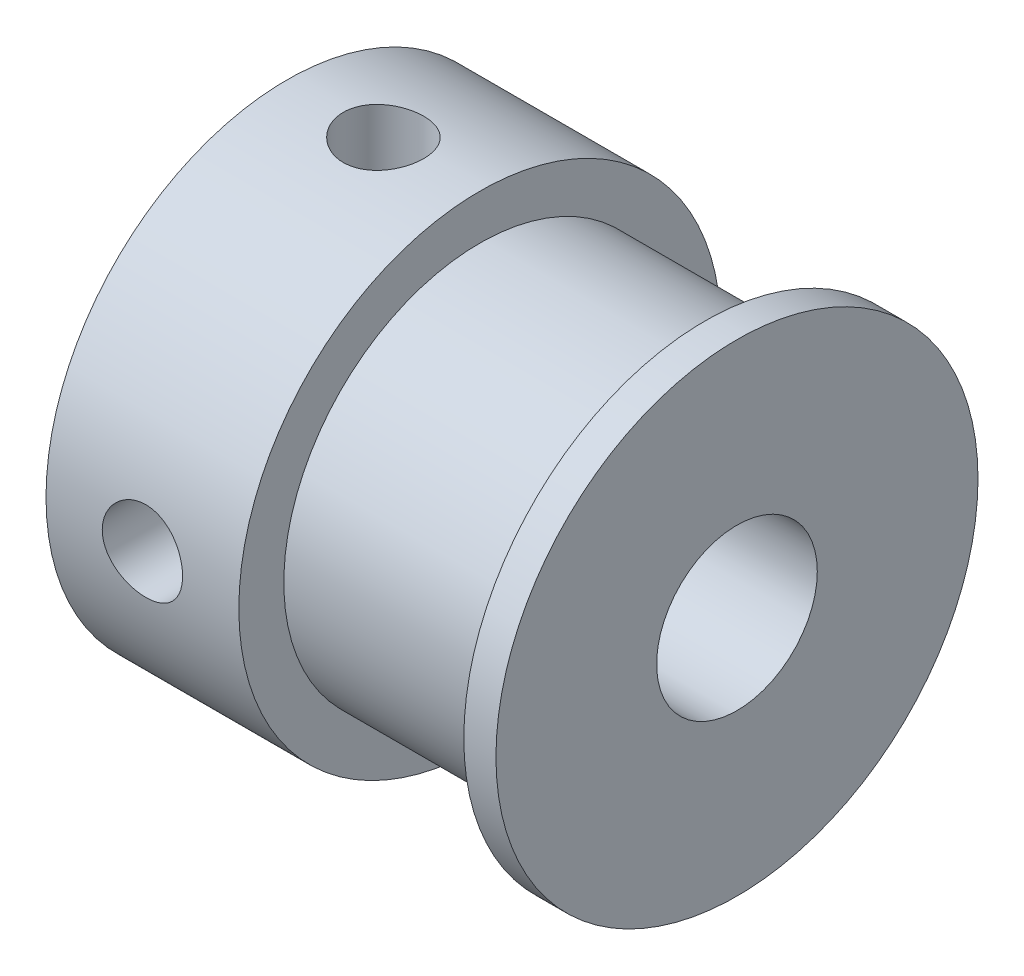
from build123d import *

# Parameters (mm, degrees)
SKETCH2_W = 1.25
SKETCH2_H = 7.5
SKETCH4_W = 1.25
SKETCH4_H = 7.5


with BuildPart() as part:
    # Sketch1 → Revolve1 (revolve)
    with BuildSketch(Plane.XY, mode=Mode.PRIVATE) as revolve1_sk:
        Polygon((0, 2.5), (0, 7.5), (6, 7.5), (6, 6.1), (13, 6.1), (13, 7.5), (14, 7.5), (14, 2.5), align=None)
    revolve(revolve1_sk.sketch.rotate(Axis((0, 0, 0), (-1, 0, 0)), 90), axis=Axis((0, 0, 0), (-1, 0, 0)))

    # Sketch2 → M3x0.5 Tapped Hole1 (revolve, cut)
    with BuildSketch(Plane(origin=(3, 0, 0), x_dir=(0, 0, -1), z_dir=(1, 0, 0))):
        with Locations((0.625, 3.75)):
            Rectangle(SKETCH2_W, SKETCH2_H)
    revolve(axis=Axis((3, -6.35, 0), (0, 1, 0)), mode=Mode.SUBTRACT)

    # Sketch4 → M3x0.5 Tapped Hole2 (revolve, cut)
    with BuildSketch(Plane.YZ.offset(3)):
        with Locations((0.625, 3.75)):
            Rectangle(SKETCH4_W, SKETCH4_H)
    revolve(axis=Axis((3, 0, -6.35), (0, 0, 1)), mode=Mode.SUBTRACT)


solid = part.part
